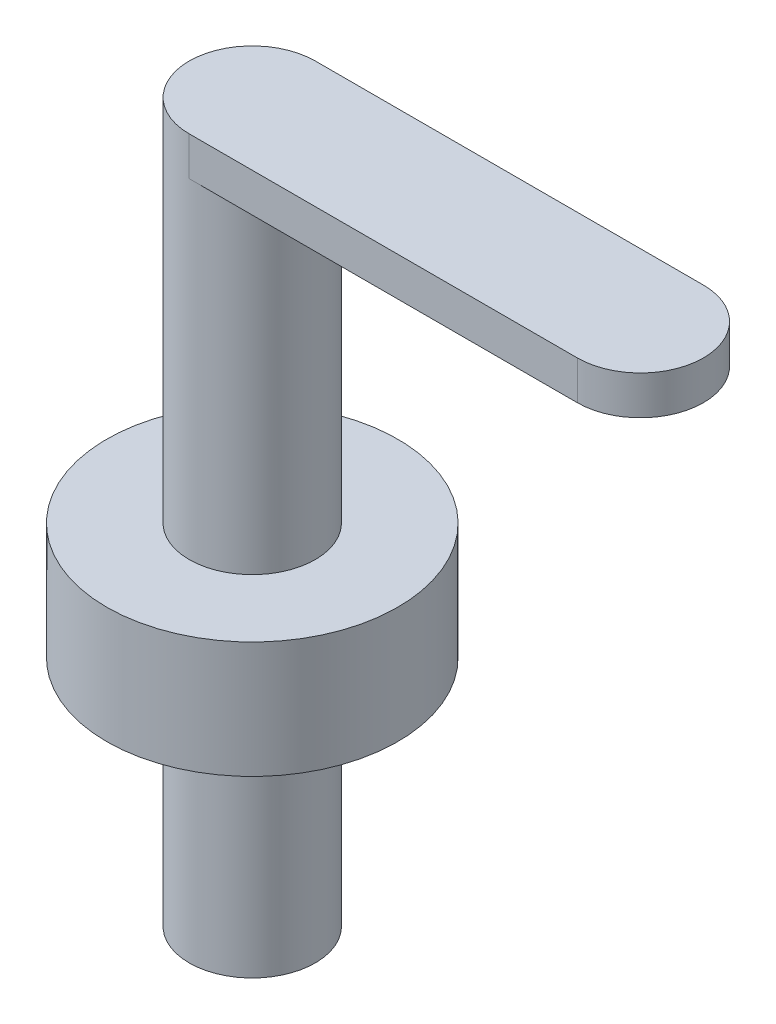
from build123d import *

# Parameters (mm, degrees)
SALIENTE_EXTRUIR1_DEPTH      = 20
SALIENTE_EXTRUIR1_DEPTH_BACK = 15
CROQUIS1_R                   = 3.25
CROQUIS1_3_R                 = 7.5
CROQUIS1_3_R_2               = 3.25
SALIENTE_EXTRUIR2_DEPTH      = 3
SALIENTE_EXTRUIR3_DEPTH      = 2


with BuildPart() as part:
    # Croquis1 → Saliente-Extruir1 (new, two sides: drawn at the far end of the back side and taken through both)
    with BuildSketch(Plane(origin=(0, 0, 0), x_dir=(1, 0, 0), z_dir=(0, 1, 0)).offset(-SALIENTE_EXTRUIR1_DEPTH_BACK)):
        Circle(CROQUIS1_R)
    extrude(amount=SALIENTE_EXTRUIR1_DEPTH + SALIENTE_EXTRUIR1_DEPTH_BACK)

    # Croquis1<3> → Saliente-Extruir2 (add, symmetric)
    with BuildSketch(Plane(origin=(0, 0, 0), x_dir=(1, 0, 0), z_dir=(0, 1, 0))):
        Circle(CROQUIS1_3_R)
        Circle(CROQUIS1_3_R_2, mode=Mode.SUBTRACT)
    extrude(amount=SALIENTE_EXTRUIR2_DEPTH, both=True)

    # Croquis2 → Saliente-Extruir3 (add)
    with BuildSketch(Plane(origin=(0, 20, 0), x_dir=(1, 0, 0), z_dir=(0, 1, 0))):
        with BuildLine():
            Line((0, 3.25), (20, 3.25))
            ThreePointArc((20, 3.25), (23.25, 0), (20, -3.25))
            Line((20, -3.25), (0, -3.25))
            ThreePointArc((0, -3.25), (-3.25, 0), (0, 3.25))
        make_face()
    extrude(amount=SALIENTE_EXTRUIR3_DEPTH)


solid = part.part
